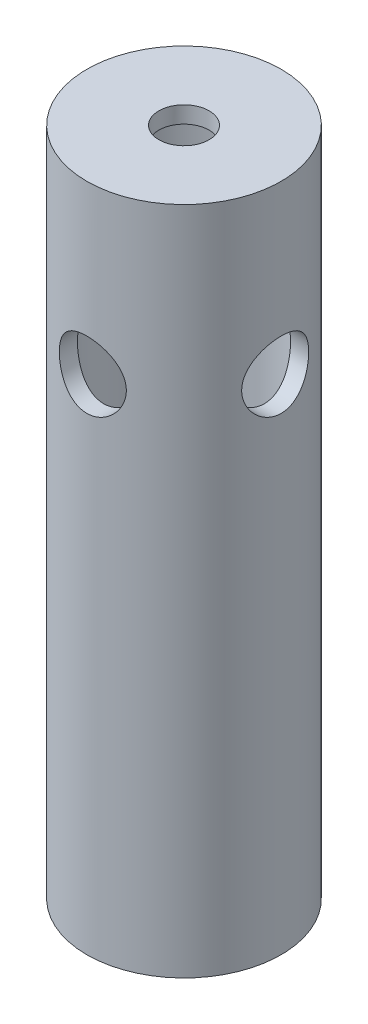
from build123d import *

# Parameters (mm, degrees)
SKETCH1_R           = 5.8
BOSS_EXTRUDE1_DEPTH = 40
SKETCH3_R           = 4.8
CUT_EXTRUDE1_DEPTH  = 39
SKETCH6_R           = 2
CUT_EXTRUDE3_DEPTH  = 41.832340124
CIRPATTERN1_COUNT   = 4
CUT_EXTRUDE4_REACH  = 42.832
SKETCH7_R           = 1.5


with BuildPart() as part:
    # Sketch1 → Boss-Extrude1 (new body)
    with BuildSketch(Plane(origin=(0, 0, 0), x_dir=(1, 0, 0), z_dir=(0, 1, 0))):
        with Locations(Location((0, 0, 0), (0, 0, 270))):
            Circle(SKETCH1_R)
    extrude(amount=BOSS_EXTRUDE1_DEPTH)

    # Sketch3 → Cut-Extrude1 (cut)
    with BuildSketch(Plane.XZ):
        with Locations(Location((0, 0, 0), (0, 0, 270))):
            Circle(SKETCH3_R)
    extrude(amount=-CUT_EXTRUDE1_DEPTH, mode=Mode.SUBTRACT)

    # Sketch6 → Cut-Extrude3 (cut, through all)
    with BuildSketch(Plane.XY):
        with Locations(Location((0, 30, 0), (0, 0, 90))):
            Circle(SKETCH6_R)
    cut_extrude3 = extrude(amount=-CUT_EXTRUDE3_DEPTH, mode=Mode.SUBTRACT)

    # CirPattern1: Cut-Extrude3 ×4 about axis
    cirpattern1_axis = Axis((0, 40, 0), (0, -1, 0))
    for i in range(1, CIRPATTERN1_COUNT):
        add(cut_extrude3.rotate(cirpattern1_axis, i * 360 / CIRPATTERN1_COUNT), mode=Mode.SUBTRACT)

    # Sketch7 → Cut-Extrude4 (cut, up to next)
    with BuildSketch(Plane(origin=(0, 40, 0), x_dir=(1, 0, 0), z_dir=(0, 1, 0)), mode=Mode.PRIVATE) as cut_extrude4_sk1:
        with Locations(Location((0, 0, 0), (0, 0, 270))):
            Circle(SKETCH7_R)
    cut_extrude4_tool1 = extrude(cut_extrude4_sk1.sketch, amount=-CUT_EXTRUDE4_REACH, mode=Mode.PRIVATE) & part.part
    add(cut_extrude4_tool1.solids().sort_by_distance((0, 40, 0))[0], mode=Mode.SUBTRACT)


solid = part.part
